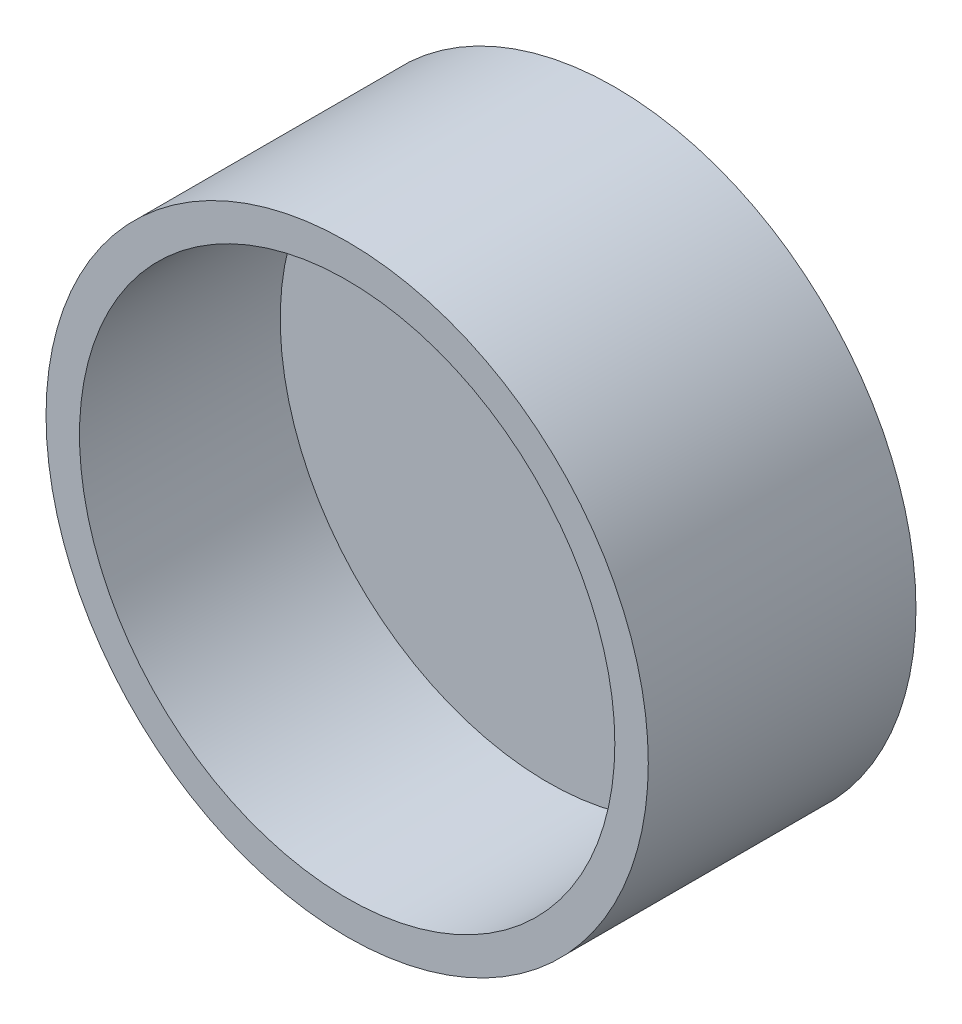
from build123d import *

# Parameters (mm, degrees)
SKETCH1_R           = 22.5
BOSS_EXTRUDE1_DEPTH = 20
SKETCH2_R           = 20
CUT_EXTRUDE1_DEPTH  = 15


with BuildPart() as part:
    # Sketch1 → Boss-Extrude1 (new body)
    with BuildSketch(Plane.XY):
        Circle(SKETCH1_R)
    extrude(amount=BOSS_EXTRUDE1_DEPTH)

    # Sketch2 → Cut-Extrude1 (cut)
    with BuildSketch(Plane.XY.offset(20)):
        Circle(SKETCH2_R)
    extrude(amount=-CUT_EXTRUDE1_DEPTH, mode=Mode.SUBTRACT)


solid = part.part
